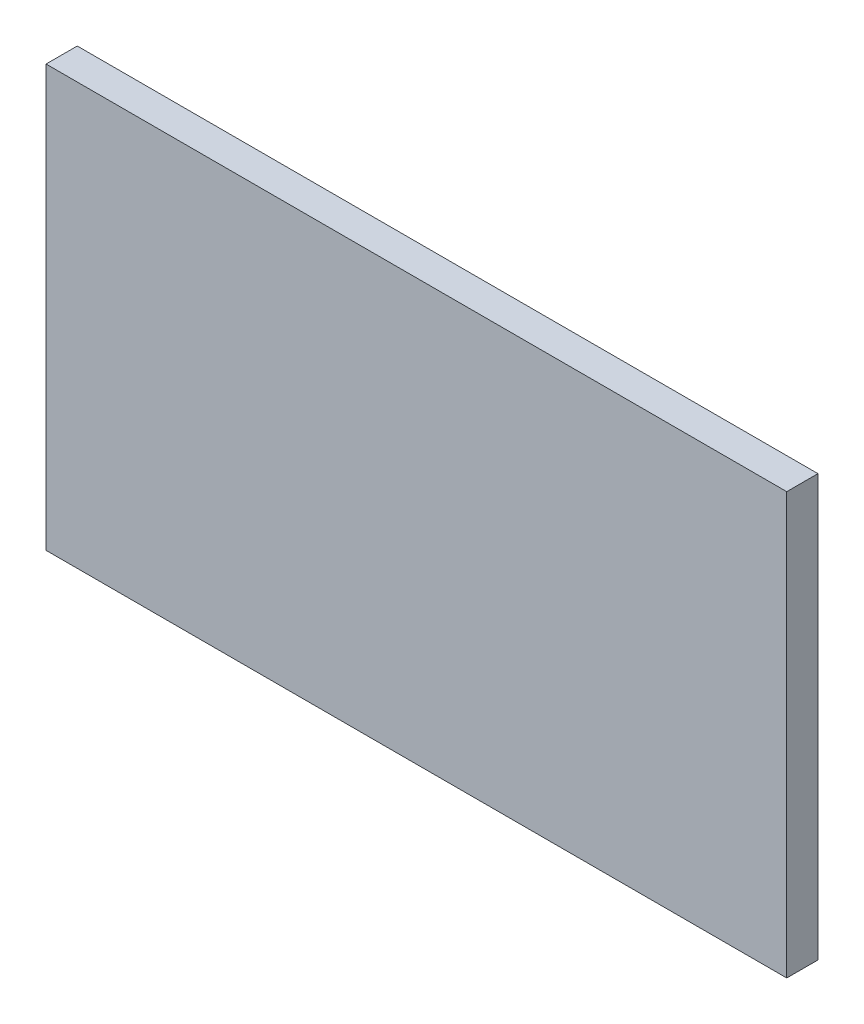
from build123d import *

# Parameters (mm, degrees)
SKETCH_1_W      = 23.74
SKETCH_1_H      = 13.5
EXTRUDE_1_DEPTH = 1


with BuildPart() as part:
    # 草图1 → 凸台-拉伸1 (new body)
    with BuildSketch(Plane.XY):
        Rectangle(SKETCH_1_W, SKETCH_1_H)
    extrude(amount=EXTRUDE_1_DEPTH)


solid = part.part
